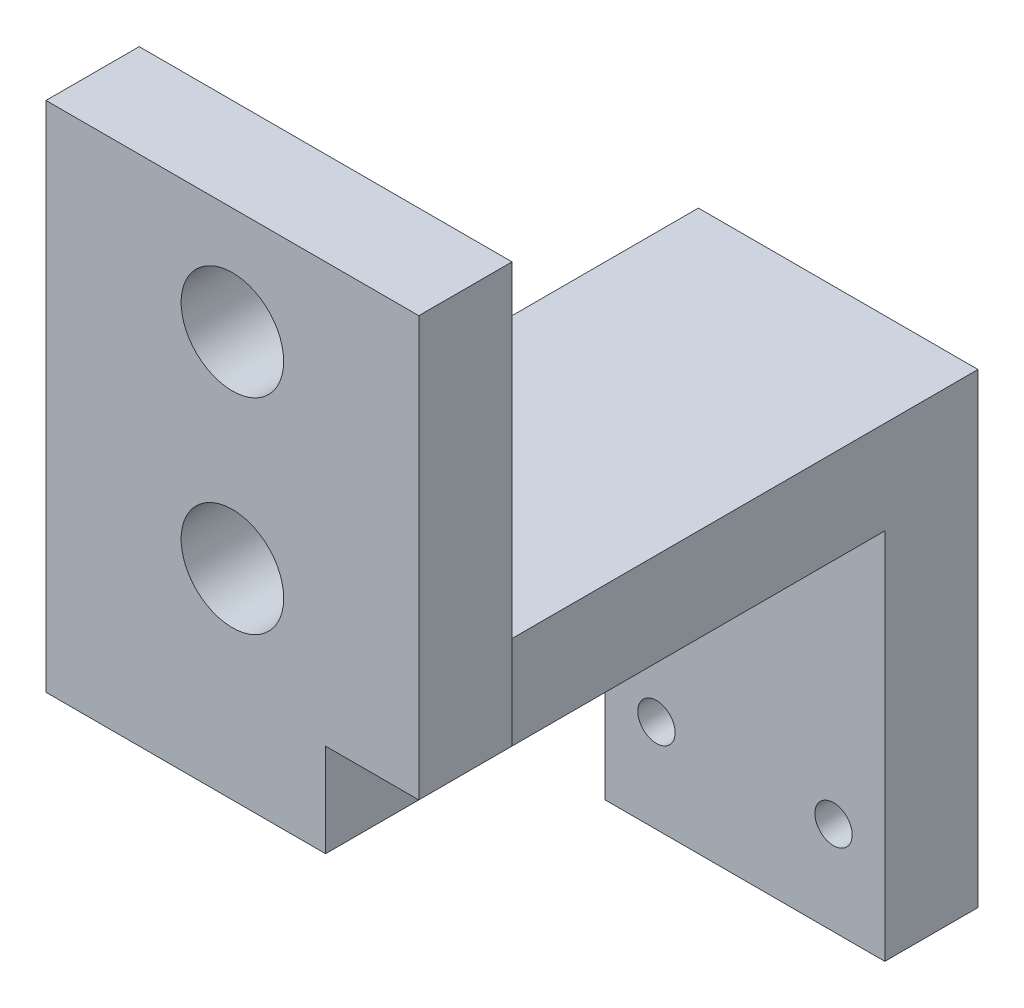
from build123d import *

# Parameters (mm, degrees)
ESQUISSE1_W             = 20
ESQUISSE1_H             = 22.5
ESQUISSE1_R             = 2.75
BOSS_EXTRU_1_DEPTH      = 5
BOSS_EXTRU_2_DEPTH      = 15
ENL_V_MAT_EXTRU_1_REACH = 66.95
ESQUISSE3_R             = 1


with BuildPart() as part:
    # Esquisse1 → Boss.-Extru.1 (new body)
    with BuildSketch(Plane.XY):
        with Locations((-27.825146679, -3.282272289)):
            Rectangle(ESQUISSE1_W, ESQUISSE1_H)
        with Locations((-27.825146679, 2.217727711)):
            Circle(ESQUISSE1_R, mode=Mode.SUBTRACT)
        with Locations((-27.825146679, -8.782272289)):
            Circle(ESQUISSE1_R, mode=Mode.SUBTRACT)
    extrude(amount=BOSS_EXTRU_1_DEPTH)

    # Esquisse4 → Boss.-Extru.2 (add)
    with BuildSketch(Plane.ZY.offset(37.825146679)):
        Polygon((5, -14.532272289), (-30, -14.532272289), (-30, -39.532272289), (-25, -39.532272289), (-25, -19.532272289), (5, -19.532272289), align=None)
    extrude(amount=-BOSS_EXTRU_2_DEPTH)

    # Esquisse3 → Enlèv. mat.-Extru.1 (cut, up to next)
    with BuildSketch(Plane.XY.offset(-30), mode=Mode.PRIVATE) as enl_v_mat_extru_1_sk1:
        with Locations((-25.575146679, -34.532272289)):
            Circle(ESQUISSE3_R)
    enl_v_mat_extru_1_tool1 = extrude(enl_v_mat_extru_1_sk1.sketch, amount=ENL_V_MAT_EXTRU_1_REACH, mode=Mode.PRIVATE) & part.part
    # Esquisse3 → Enlèv. mat.-Extru.1 (cut, up to next)
    with BuildSketch(Plane.XY.offset(-30), mode=Mode.PRIVATE) as enl_v_mat_extru_1_sk2:
        with Locations((-35.075146679, -34.532272289)):
            Circle(ESQUISSE3_R)
    enl_v_mat_extru_1_tool2 = extrude(enl_v_mat_extru_1_sk2.sketch, amount=ENL_V_MAT_EXTRU_1_REACH, mode=Mode.PRIVATE) & part.part
    add(enl_v_mat_extru_1_tool1.solids().sort_by_distance((-25.575147, -34.532272, -30))[0], mode=Mode.SUBTRACT)
    add(enl_v_mat_extru_1_tool2.solids().sort_by_distance((-35.075147, -34.532272, -30))[0], mode=Mode.SUBTRACT)


solid = part.part
